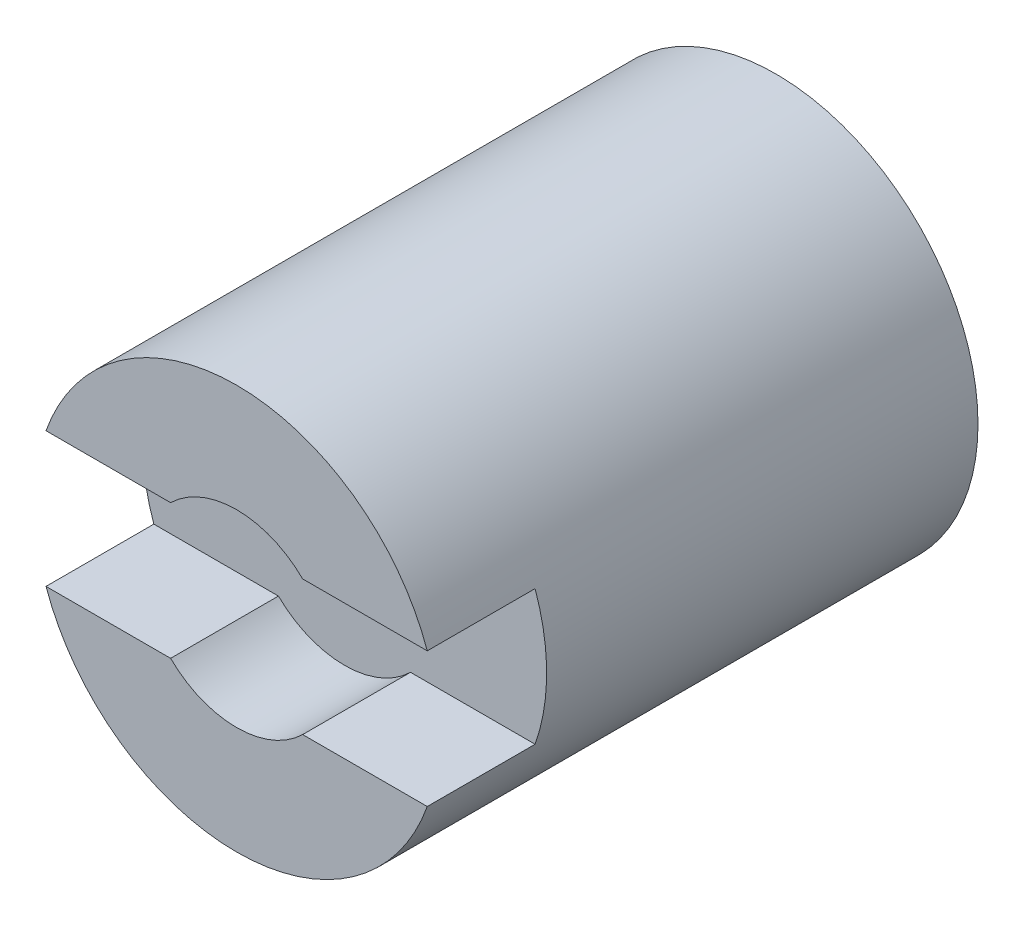
from build123d import *

# Parameters (mm, degrees)
SKETCH_1_R          = 7.5
EXTRUDE_1_DEPTH     = 20
SKETCH_2_R          = 3.5
CUT_EXTRUDE_1_DEPTH = 4
SKETCH_3_R          = 1.75
CUT_EXTRUDE_2_DEPTH = 14
SKETCH_4_R          = 1.4
CUT_EXTRUDE_3_DEPTH = 14
SKETCH_5_W          = 18
SKETCH_5_H          = 5
CUT_EXTRUDE_4_DEPTH = 4


with BuildPart() as part:
    # Эскиз1 → Бобышка-Вытянуть1 (new body)
    with BuildSketch(Plane.XY):
        Circle(SKETCH_1_R)
    extrude(amount=EXTRUDE_1_DEPTH)

    # Эскиз2 → Вырез-Вытянуть1 (cut)
    with BuildSketch(Plane.XY.offset(20)):
        Circle(SKETCH_2_R)
    extrude(amount=-CUT_EXTRUDE_1_DEPTH, mode=Mode.SUBTRACT)

    # Эскиз3 → Вырез-Вытянуть2 (cut)
    with BuildSketch(Plane(origin=(0, 0, 0), x_dir=(-1, 0, 0), z_dir=(0, 0, -1))):
        Circle(SKETCH_3_R)
    extrude(amount=-CUT_EXTRUDE_2_DEPTH, mode=Mode.SUBTRACT)

    # Эскиз4 → Вырез-Вытянуть3 (cut)
    with BuildSketch(Plane(origin=(0, 0, 0), x_dir=(1, 0, 0), z_dir=(0, 1, 0))):
        with Locations(Location((0, -7, 0), (0, 0, 270))):
            Circle(SKETCH_4_R)
    extrude(amount=-CUT_EXTRUDE_3_DEPTH, mode=Mode.SUBTRACT)

    # Эскиз5 → Вырез-Вытянуть4 (cut)
    with BuildSketch(Plane.XY.offset(20)):
        Rectangle(SKETCH_5_W, SKETCH_5_H)
    extrude(amount=-CUT_EXTRUDE_4_DEPTH, mode=Mode.SUBTRACT)


solid = part.part
